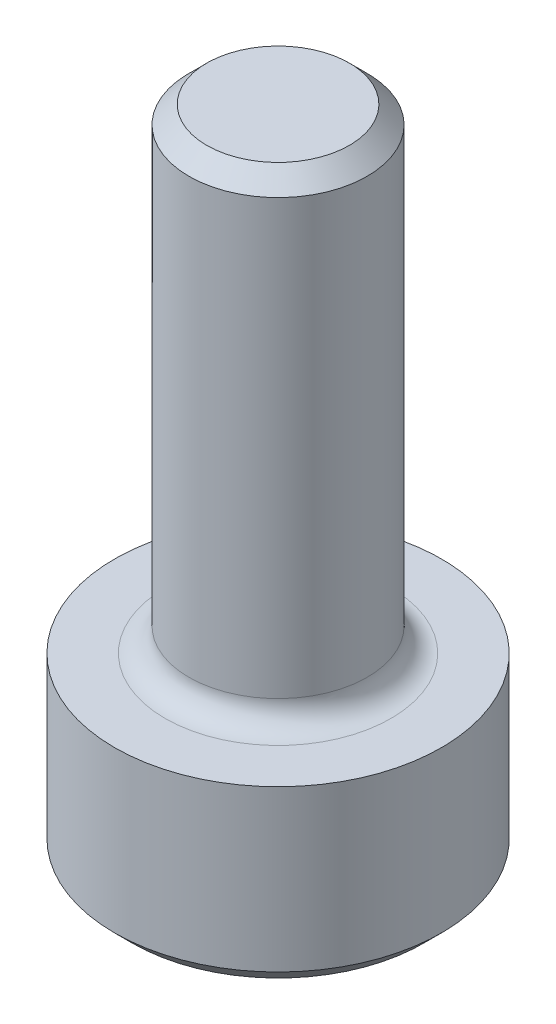
from build123d import *

# Parameters (mm, degrees)
SKETCH2_R           = 1.5
BOSS_EXTRUDE1_DEPTH = 8
SKETCH3_R           = 2.75
BOSS_EXTRUDE2_DEPTH = 3
FILLET1_R           = 0.4
CHAMFER1_SIZE       = 0.3
CUT_EXTRUDE1_DEPTH  = 2.5


with BuildPart() as part:
    # Sketch2 → Boss-Extrude1 (new body)
    with BuildSketch(Plane(origin=(0, 0, 0), x_dir=(1, 0, 0), z_dir=(0, 1, 0))):
        with Locations(Location((0, 0, 0), (0, 0, 270))):
            Circle(SKETCH2_R)
    extrude(amount=BOSS_EXTRUDE1_DEPTH)

    # Sketch3 → Boss-Extrude2 (add)
    with BuildSketch(Plane(origin=(0, 0, 0), x_dir=(1, 0, 0), z_dir=(0, 1, 0))):
        with Locations(Location((0, 0, 0), (0, 0, 270))):
            Circle(SKETCH3_R)
    extrude(amount=-BOSS_EXTRUDE2_DEPTH)

    # Fillet1
    fillet1_edges = [part.edges().sort_by_distance(p)[0] for p in [
        (0, 0, -1.5),
    ]]
    fillet(fillet1_edges, radius=FILLET1_R)

    # Chamfer1
    chamfer1_edges = [part.edges().sort_by_distance(p)[0] for p in [
        (0, 8, -1.5),
        (0, -3, -2.75),
    ]]
    chamfer(chamfer1_edges, length=CHAMFER1_SIZE)

    # Sketch4 → Cut-Extrude1 (cut)
    with BuildSketch(Plane.XZ.offset(3)):
        Polygon((0, 1.443375673), (-1.25, 0.721687836), (-1.25, -0.721687836), (0, -1.443375673), (1.25, -0.721687836), (1.25, 0.721687836), align=None)
    extrude(amount=-CUT_EXTRUDE1_DEPTH, mode=Mode.SUBTRACT)


solid = part.part
